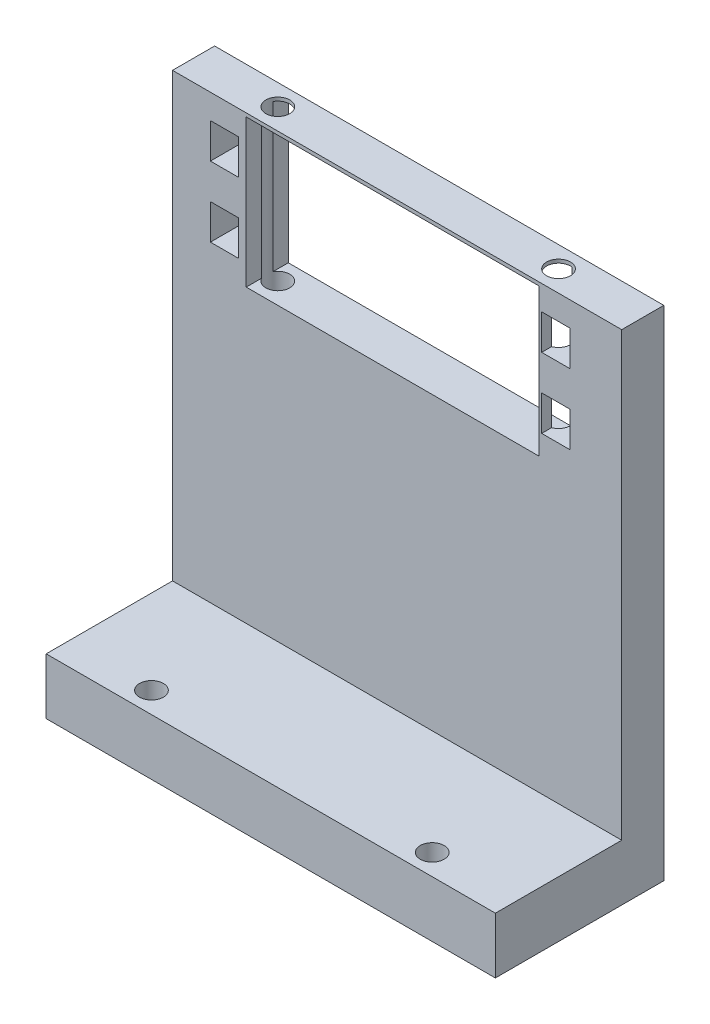
from build123d import *

# Parameters (mm, degrees)
SKETCH_1_W                                      = 64
SKETCH_1_H                                      = 8
SERVO_FOOT_DEPTH                                = 24
SKETCH_2_W                                      = 64
SKETCH_2_H                                      = 71
SERVO_FACE_PLATE_DEPTH                          = 6
MG995_BODY_WINDOW_REFERENCE_DEPTH               = 87.406018309
MG995_BODY_WINDOW_REFERENCE_DEPTH_BACK          = 87.406018309
SKETCH_3_W                                      = 41.7
SKETCH_3_H                                      = 21
MG995_47P2X10_REFERENCE_SLOTS_VERIFY_DEPTH      = 87.406018309
MG995_47P2X10_REFERENCE_SLOTS_VERIFY_DEPTH_BACK = 87.406018309
SKETCH_4_W                                      = 4
SKETCH_4_H                                      = 5
SERVO_FOOT_M3_DEPTH                             = 87.406018309
SERVO_FOOT_M3_DEPTH_BACK                        = 87.406018309
SKETCH_5_R                                      = 1.7


with BuildPart() as part:
    # 草图1 → Servo_foot (new body)
    with BuildSketch(Plane.XY):
        with Locations((11, 4)):
            Rectangle(SKETCH_1_W, SKETCH_1_H)
    extrude(amount=SERVO_FOOT_DEPTH)

    # 草图2 → Servo_face_plate (add)
    with BuildSketch(Plane.XY):
        with Locations((11, 35.5)):
            Rectangle(SKETCH_2_W, SKETCH_2_H)
    extrude(amount=SERVO_FACE_PLATE_DEPTH)

    # 草图3 → MG995_body_window_REFERENCE (cut, two sides: drawn at the far end of the back side and taken through both)
    with BuildSketch(Plane.XY.offset(-MG995_BODY_WINDOW_REFERENCE_DEPTH_BACK)):
        with Locations((10.35, 60)):
            Rectangle(SKETCH_3_W, SKETCH_3_H)
    extrude(amount=MG995_BODY_WINDOW_REFERENCE_DEPTH + MG995_BODY_WINDOW_REFERENCE_DEPTH_BACK, mode=Mode.SUBTRACT)

    # 草图4 → MG995_47p2x10_reference_slots_VERIFY (cut, two sides: drawn at the far end of the back side and taken through both)
    with BuildSketch(Plane.XY.offset(-MG995_47P2X10_REFERENCE_SLOTS_VERIFY_DEPTH_BACK)):
        with Locations((-13.6, 55)):
            Rectangle(SKETCH_4_W, SKETCH_4_H)
        with Locations((-13.6, 65)):
            Rectangle(SKETCH_4_W, SKETCH_4_H)
        with Locations((33.6, 55)):
            Rectangle(SKETCH_4_W, SKETCH_4_H)
        with Locations((33.6, 65)):
            Rectangle(SKETCH_4_W, SKETCH_4_H)
    extrude(amount=MG995_47P2X10_REFERENCE_SLOTS_VERIFY_DEPTH + MG995_47P2X10_REFERENCE_SLOTS_VERIFY_DEPTH_BACK, mode=Mode.SUBTRACT)

    # 草图5 → Servo_foot_M3 (cut, two sides: drawn at the far end of the back side and taken through both)
    with BuildSketch(Plane(origin=(0, 0, 0), x_dir=(1, 0, 0), z_dir=(0, 1, 0)).offset(-SERVO_FOOT_M3_DEPTH_BACK)):
        with Locations(Location((-9, -3, 0), (0, 0, 270))):
            Circle(SKETCH_5_R)
        with Locations(Location((-9, -21, 0), (0, 0, 270))):
            Circle(SKETCH_5_R)
        with Locations(Location((31, -3, 0), (0, 0, 270))):
            Circle(SKETCH_5_R)
        with Locations(Location((31, -21, 0), (0, 0, 270))):
            Circle(SKETCH_5_R)
    extrude(amount=SERVO_FOOT_M3_DEPTH + SERVO_FOOT_M3_DEPTH_BACK, mode=Mode.SUBTRACT)


solid = part.part
